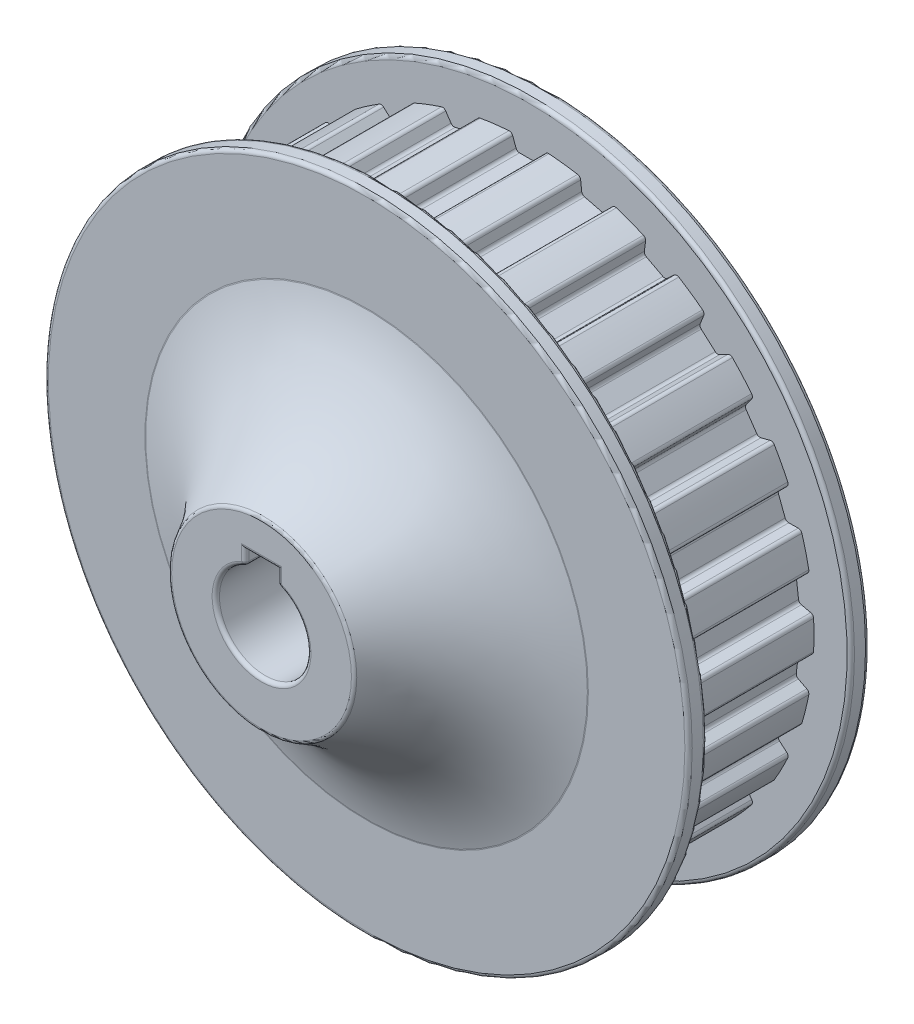
from build123d import *

# Parameters (mm, degrees)
BOSS_EXTRUDE1_DEPTH      = 7.25
BOSS_EXTRUDE1_DEPTH_BACK = 7.25
SKETCH7_R                = 38.647197245
CUT_EXTRUDE3_DEPTH       = 59.732118213
CUT_EXTRUDE3_DEPTH_BACK  = 59.732118213
SKETCH15_R               = 8.008120878
SKETCH15_R_2             = 2.25
BOSS_EXTRUDE2_DEPTH      = 5.5
SKETCH16_R               = 5
CUT_EXTRUDE4_DEPTH       = 3
BOSS_EXTRUDE3_START      = 7.5
SKETCH17_R               = 38.647197245
SKETCH17_R_2             = 5
BOSS_EXTRUDE3_DEPTH      = 7.5
CUT_EXTRUDE2_DEPTH       = 59.732118213
CUT_EXTRUDE2_DEPTH_BACK  = 59.732118213
FILLET2_R                = 0.51
BOSS_EXTRUDE4_START      = 2.5
SKETCH18_R               = 43.647197245
SKETCH18_R_2             = 5
BOSS_EXTRUDE4_DEPTH      = 2.5
BOSS_EXTRUDE5_START      = -2.5
SKETCH19_R               = 43.647197245
SKETCH19_R_2             = 30
BOSS_EXTRUDE5_DEPTH      = 2.5
FILLET3_R                = 0.5


with BuildPart() as part:
    # Sketch7 → Boss-Extrude1 (new, two sides: drawn at the far end of the back side and taken through both)
    with BuildSketch(Plane.XY.offset(-BOSS_EXTRUDE1_DEPTH_BACK)):
        Circle(SKETCH7_R)
    extrude(amount=BOSS_EXTRUDE1_DEPTH + BOSS_EXTRUDE1_DEPTH_BACK)

    # Sketch14 → Revolve1 (revolve)
    with BuildSketch(Plane(origin=(0, 0, 0), x_dir=(0, 0, -1), z_dir=(1, 0, 0))):
        with BuildLine():
            Line((-21.5, 0), (0, 0))
            Line((0, 0), (0, 30))
            Line((0, 30), (-7.25, 30))
            ThreePointArc((-7.25, 30), (-12.43641035, 19.671434142), (-21.5, 12.5))
            Line((-21.5, 12.5), (-21.5, 0))
        make_face()
    revolve(axis=Axis((0, 0, -36.129595921), (0, 0, 1)))

    # Sketch10 → Cut-Extrude3 (cut, two sides: drawn at the far end of the back side and taken through both)
    with BuildSketch(Plane.XY.offset(-CUT_EXTRUDE3_DEPTH_BACK)):
        with BuildLine():
            Line((2.2, 7.7), (-2.2, 7.7))
            Line((-2.2, 7.7), (-2.2, 5.796550698))
            ThreePointArc((-2.2, 5.796550698), (0, -6.2), (2.2, 5.796550698))
            Line((2.2, 5.796550698), (2.2, 7.7))
        make_face()
    extrude(amount=CUT_EXTRUDE3_DEPTH + CUT_EXTRUDE3_DEPTH_BACK, mode=Mode.SUBTRACT)

    # Sketch15 → Boss-Extrude2 (add)
    with BuildSketch(Plane(origin=(0, 0, -7.25), x_dir=(-1, 0, 0), z_dir=(0, 0, -1))):
        Circle(SKETCH15_R)
        Circle(SKETCH15_R_2, mode=Mode.SUBTRACT)
    extrude(amount=-BOSS_EXTRUDE2_DEPTH)

    # Sketch16 → Cut-Extrude4 (cut)
    with BuildSketch(Plane(origin=(0, 0, -7.25), x_dir=(-1, 0, 0), z_dir=(0, 0, -1))):
        Circle(SKETCH16_R)
    extrude(amount=-CUT_EXTRUDE4_DEPTH, mode=Mode.SUBTRACT)

    # Sketch17 → Boss-Extrude3 (add)
    with BuildSketch(Plane(origin=(0, 0, -7.25), x_dir=(-1, 0, 0), z_dir=(0, 0, -1)).offset(BOSS_EXTRUDE3_START)):
        Circle(SKETCH17_R)
        Circle(SKETCH17_R_2, mode=Mode.SUBTRACT)
    extrude(amount=-BOSS_EXTRUDE3_DEPTH)

    # Sketch8 → Cut-Extrude2 (cut, two sides: drawn at the far end of the back side and taken through both)
    with BuildSketch(Plane.XY.offset(-CUT_EXTRUDE2_DEPTH_BACK)):
        Polygon((-1.629816853, 36.667198316), (-2.350477527, 38.647197245), (2.350477527, 38.647197245), (1.629816853, 36.667198316), align=None)
        Polygon((7.192577586, 35.991756875), (6.96670276, 38.086686022), (11.531056603, 36.961673841), (10.357492259, 35.21167547), align=None)
        Polygon((15.596965558, 33.22460535), (15.879003605, 35.312715047), (20.041492583, 33.128072303), (18.483227864, 31.709778035), align=None)
        Polygon((23.094914586, 28.526560528), (23.868474478, 30.48649743), (27.387189863, 27.369187619), (25.534785449, 26.365023561), align=None)
        Polygon((29.250671124, 22.170655698), (30.470796374, 23.888515396), (33.141243215, 20.019705233), (31.102354119, 19.48802975), align=None)
        Polygon((33.706484978, 14.526272947), (35.30226634, 15.902219679), (36.969247976, 11.506750348), (34.86236702, 11.478462487), align=None)
        Polygon((36.203400443, 6.037676012), (38.082096906, 6.991744756), (38.648734422, 2.325064958), (36.596305869, 2.801808707), align=None)
        Polygon((36.596305869, -2.801808707), (38.648734422, -2.325064958), (38.082096906, -6.991744756), (36.203400443, -6.037676012), align=None)
        Polygon((34.86236702, -11.478462487), (36.969247976, -11.506750348), (35.30226634, -15.902219679), (33.706484978, -14.526272947), align=None)
        Polygon((31.102354119, -19.48802975), (33.141243215, -20.019705233), (30.470796374, -23.888515396), (29.250671124, -22.170655698), align=None)
        Polygon((25.534785449, -26.365023561), (27.387189863, -27.369187619), (23.868474478, -30.48649743), (23.094914586, -28.526560528), align=None)
        Polygon((18.483227864, -31.709778035), (20.041492583, -33.128072303), (15.879003605, -35.312715047), (15.596965558, -33.22460535), align=None)
        Polygon((10.357492259, -35.21167547), (11.531056603, -36.961673841), (6.96670276, -38.086686022), (7.192577586, -35.991756875), align=None)
        Polygon((1.629816853, -36.667198316), (2.350477527, -38.647197245), (-2.350477527, -38.647197245), (-1.629816853, -36.667198316), align=None)
        Polygon((-7.192577586, -35.991756875), (-6.96670276, -38.086686022), (-11.531056603, -36.961673841), (-10.357492259, -35.21167547), align=None)
        Polygon((-15.596965558, -33.22460535), (-15.879003605, -35.312715047), (-20.041492583, -33.128072303), (-18.483227864, -31.709778035), align=None)
        Polygon((-23.094914586, -28.526560528), (-23.868474478, -30.48649743), (-27.387189863, -27.369187619), (-25.534785449, -26.365023561), align=None)
        Polygon((-29.250671124, -22.170655698), (-30.470796374, -23.888515396), (-33.141243215, -20.019705233), (-31.102354119, -19.48802975), align=None)
        Polygon((-33.706484978, -14.526272947), (-35.30226634, -15.902219679), (-36.969247976, -11.506750348), (-34.86236702, -11.478462487), align=None)
        Polygon((-36.203400443, -6.037676012), (-38.082096906, -6.991744756), (-38.648734422, -2.325064958), (-36.596305869, -2.801808707), align=None)
        Polygon((-36.596305869, 2.801808707), (-38.648734422, 2.325064958), (-38.082096906, 6.991744756), (-36.203400443, 6.037676012), align=None)
        Polygon((-34.86236702, 11.478462487), (-36.969247976, 11.506750348), (-35.30226634, 15.902219679), (-33.706484978, 14.526272947), align=None)
        Polygon((-31.102354119, 19.48802975), (-33.141243215, 20.019705233), (-30.470796374, 23.888515396), (-29.250671124, 22.170655698), align=None)
        Polygon((-25.534785449, 26.365023561), (-27.387189863, 27.369187619), (-23.868474478, 30.48649743), (-23.094914586, 28.526560528), align=None)
        Polygon((-18.483227864, 31.709778035), (-20.041492583, 33.128072303), (-15.879003605, 35.312715047), (-15.596965558, 33.22460535), align=None)
        Polygon((-10.357492259, 35.21167547), (-11.531056603, 36.961673841), (-6.96670276, 38.086686022), (-7.192577586, 35.991756875), align=None)
    extrude(amount=CUT_EXTRUDE2_DEPTH + CUT_EXTRUDE2_DEPTH_BACK, mode=Mode.SUBTRACT)

    # Fillet2
    fillet2_edges = [part.edges().sort_by_distance(p)[0] for p in [
        (-11.489567567, -36.899806124, -3.75),
        (-6.974688116, -38.012623963, -3.75),
        (-2.325, -38.577198316, -3.75),
        (2.325, -38.577198316, -3.75),
        (6.974688116, -38.012623963, -3.75),
        (11.489567567, -36.899806124, -3.75),
        (15.86903271, -35.238894076, -3.75),
        (19.986403229, -33.077931326, -3.75),
        (23.841126805, -30.417207754, -3.75),
        (27.321701784, -27.333687393, -3.75),
        (30.427661269, -23.827783879, -3.75),
        (33.069162341, -20.000908903, -3.75),
        (35.24585066, -15.853575815, -3.75),
        (36.894763385, -11.505750287, -3.75),
        (38.015679324, -6.958015551, -3.75),
        (38.576174887, -2.341919286, -3.75),
        (38.576174887, 2.341919286, -3.75),
        (38.015679324, 6.958015551, -3.75),
        (36.894763385, 11.505750287, -3.75),
        (35.24585066, 15.853575815, -3.75),
        (33.069162341, 20.000908903, -3.75),
        (30.427661269, 23.827783879, -3.75),
        (27.321701784, 27.333687393, -3.75),
        (23.841126805, 30.417207754, -3.75),
        (19.986403229, 33.077931326, -3.75),
        (15.86903271, 35.238894076, -3.75),
        (11.489567567, 36.899806124, -3.75),
        (6.974688116, 38.012623963, -3.75),
        (2.325, 38.577198316, -3.75),
        (-10.357492259, -35.21167547, -3.75),
        (-7.192577586, -35.991756875, -3.75),
        (-1.629816853, -36.667198316, -3.75),
        (1.629816853, -36.667198316, -3.75),
        (7.192577586, -35.991756875, -3.75),
        (10.357492259, -35.21167547, -3.75),
        (15.596965558, -33.22460535, -3.75),
        (18.483227864, -31.709778035, -3.75),
        (23.094914586, -28.526560528, -3.75),
        (25.534785449, -26.365023561, -3.75),
        (29.250671124, -22.170655698, -3.75),
        (31.102354119, -19.48802975, -3.75),
        (33.706484978, -14.526272947, -3.75),
        (34.86236702, -11.478462487, -3.75),
        (36.203400443, -6.037676012, -3.75),
        (36.596305869, -2.801808707, -3.75),
        (36.596305869, 2.801808707, -3.75),
        (36.203400443, 6.037676012, -3.75),
        (34.86236702, 11.478462487, -3.75),
        (33.706484978, 14.526272947, -3.75),
        (31.102354119, 19.48802975, -3.75),
        (29.250671124, 22.170655698, -3.75),
        (25.534785449, 26.365023561, -3.75),
        (23.094914586, 28.526560528, -3.75),
        (18.483227864, 31.709778035, -3.75),
        (15.596965558, 33.22460535, -3.75),
        (10.357492259, 35.21167547, -3.75),
        (7.192577586, 35.991756875, -3.75),
        (1.629816853, 36.667198316, -3.75),
        (-1.629816853, 36.667198316, -3.75),
        (-2.325, 38.577198316, -3.75),
        (-15.86903271, -35.238894076, -3.75),
        (-15.596965558, -33.22460535, -3.75),
        (-18.483227864, -31.709778035, -3.75),
        (-19.986403229, -33.077931326, -3.75),
        (-23.841126805, -30.417207754, -3.75),
        (-23.094914586, -28.526560528, -3.75),
        (-25.534785449, -26.365023561, -3.75),
        (-27.321701784, -27.333687393, -3.75),
        (-30.427661269, -23.827783879, -3.75),
        (-29.250671124, -22.170655698, -3.75),
        (-31.102354119, -19.48802975, -3.75),
        (-33.069162341, -20.000908903, -3.75),
        (-35.24585066, -15.853575815, -3.75),
        (-33.706484978, -14.526272947, -3.75),
        (-34.86236702, -11.478462487, -3.75),
        (-36.894763385, -11.505750287, -3.75),
        (-38.015679324, -6.958015551, -3.75),
        (-36.203400443, -6.037676012, -3.75),
        (-36.596305869, -2.801808707, -3.75),
        (-38.576174887, -2.341919286, -3.75),
        (-38.576174887, 2.341919286, -3.75),
        (-36.596305869, 2.801808707, -3.75),
        (-36.203400443, 6.037676012, -3.75),
        (-36.894763385, 11.505750287, -3.75),
        (-34.86236702, 11.478462487, -3.75),
        (-33.706484978, 14.526272947, -3.75),
        (-35.24585066, 15.853575815, -3.75),
        (-33.069162341, 20.000908903, -3.75),
        (-31.102354119, 19.48802975, -3.75),
        (-29.250671124, 22.170655698, -3.75),
        (-30.427661269, 23.827783879, -3.75),
        (-27.321701784, 27.333687393, -3.75),
        (-25.534785449, 26.365023561, -3.75),
        (-23.094914586, 28.526560528, -3.75),
        (-23.841126805, 30.417207754, -3.75),
        (-19.986403229, 33.077931326, -3.75),
        (-18.483227864, 31.709778035, -3.75),
        (-15.596965558, 33.22460535, -3.75),
        (-15.86903271, 35.238894076, -3.75),
        (-11.489567567, 36.899806124, -3.75),
        (-10.357492259, 35.21167547, -3.75),
        (-7.192577586, 35.991756875, -3.75),
        (-6.974688116, 38.012623963, -3.75),
        (-38.015679324, 6.958015551, -3.75),
    ]]
    fillet(fillet2_edges, radius=FILLET2_R)

    # Sketch18 → Boss-Extrude4 (add)
    with BuildSketch(Plane(origin=(0, 0, -14.75), x_dir=(-1, 0, 0), z_dir=(0, 0, -1)).offset(BOSS_EXTRUDE4_START)):
        Circle(SKETCH18_R)
        Circle(SKETCH18_R_2, mode=Mode.SUBTRACT)
    extrude(amount=-BOSS_EXTRUDE4_DEPTH)

    # Sketch19 → Boss-Extrude5 (add)
    with BuildSketch(Plane.XY.offset(7.25).offset(BOSS_EXTRUDE5_START)):
        Circle(SKETCH19_R)
        Circle(SKETCH19_R_2, mode=Mode.SUBTRACT)
    extrude(amount=BOSS_EXTRUDE5_DEPTH)

    # Fillet3
    fillet3_edges = [part.edges().sort_by_distance(p)[0] for p in [
        (2.2, 5.796550698, 9.875),
        (-2.2, 5.796550698, 9.875),
        (2.2, 6.748275349, 21.5),
        (-2.2, 6.748275349, 21.5),
        (0, 7.7, 21.5),
        (0, -30, 7.25),
        (0, -12.5, 21.5),
        (0, -6.2, 21.5),
        (5, 0, -4.25),
        (2.25, 0, -4.25),
        (-2.2, 6.748275349, -1.75),
        (2.2, 6.748275349, -1.75),
        (-43.647197245, 0, 4.75),
        (43.647197245, 0, -14.75),
        (43.647197245, 0, -17.25),
        (-43.647197245, 0, 7.25),
        (0, 7.7, -1.75),
        (0, -6.2, -1.75),
        (5, 0, -17.25),
    ]]
    fillet(fillet3_edges, radius=FILLET3_R)


solid = part.part
